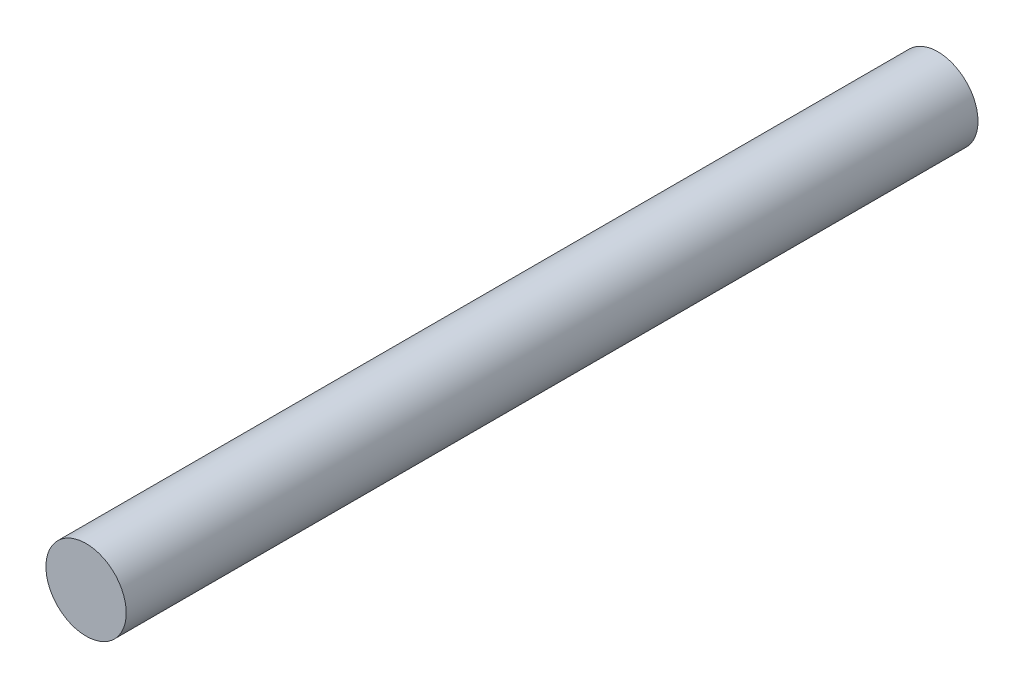
from build123d import *

# Parameters (mm, degrees)
SKETCH1_R        = 1.65
EXTRUSION1_DEPTH = 35


with BuildPart() as part:
    # Sketch1 → Extrusion1 (new body)
    with BuildSketch(Plane.XY):
        Circle(SKETCH1_R)
    extrude(amount=EXTRUSION1_DEPTH)


solid = part.part
